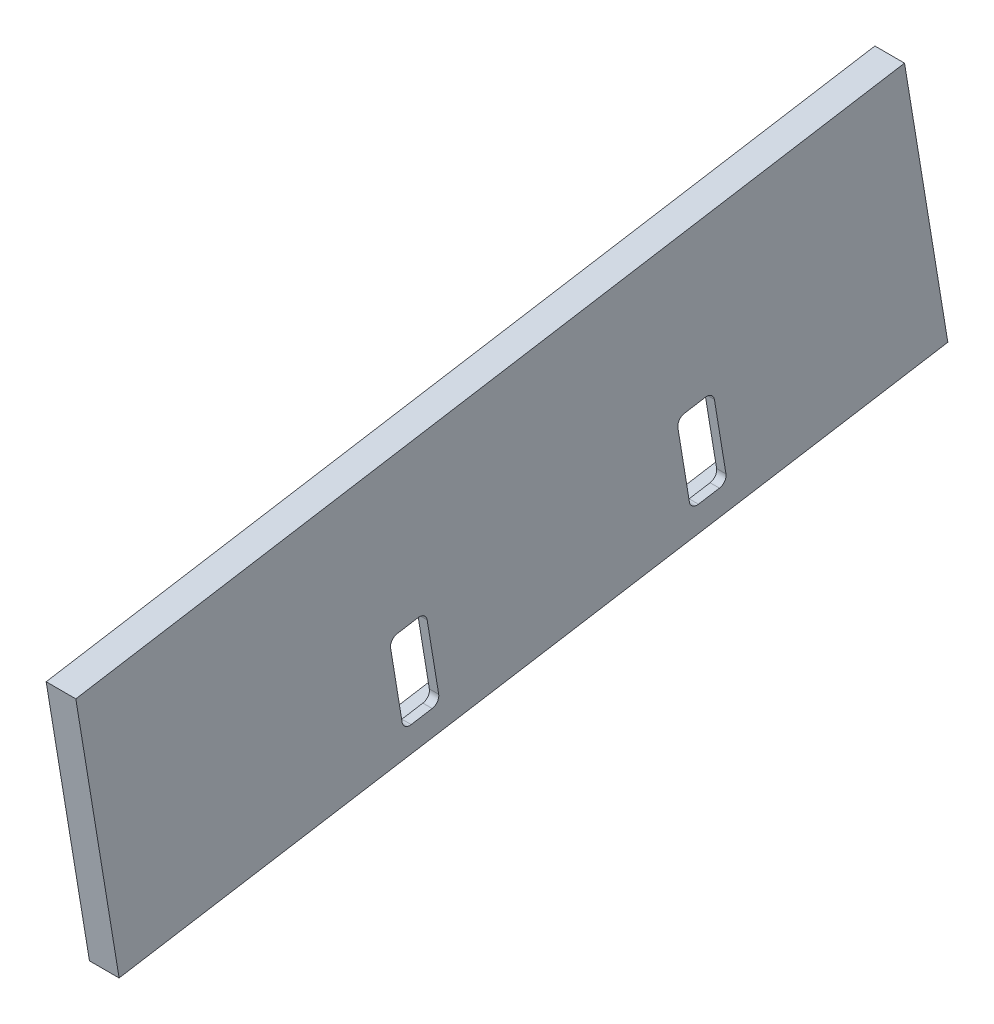
from build123d import *

# Parameters (mm, degrees)
BOSS_EXTRUDE1_START     = -109.652
BOSS_EXTRUDE1_DEPTH     = 9.525
CUT_EXTRUDE1_DEPTH      = 1399.485644649
CUT_EXTRUDE1_DEPTH_BACK = 1399.485644649
CUT_EXTRUDE2_START      = -103.127
CUT_EXTRUDE2_DEPTH      = 1296.358644649


with BuildPart() as part:
    # Sketch1 → Boss-Extrude1 (new body)
    with BuildSketch(Plane(origin=(0, 0, 0), x_dir=(0, 0, -1), z_dir=(1, 0, 0)).offset(BOSS_EXTRUDE1_START)):
        Polygon((-1044.923144897, 473.87249639), (-1311.176339914, 430.114447736), (-1297.268878193, 345.492161514), (-1031.015683176, 389.250210169), align=None)
    extrude(amount=BOSS_EXTRUDE1_DEPTH)

    # Sketch2 → Cut-Extrude1 (cut, two sides: drawn at the far end of the back side and taken through both)
    with BuildSketch(Plane(origin=(0, 0, 0), x_dir=(0, 0, -1), z_dir=(1, 0, 0)).offset(-CUT_EXTRUDE1_DEPTH_BACK)):
        with BuildLine():
            Line((-1108.923879409, 412.894172152), (-1115.653599818, 411.788159384))
            ThreePointArc((-1115.653599818, 411.788159384), (-1117.305228207, 410.762789477), (-1117.748059826, 408.869865828))
            Line((-1117.748059826, 408.869865828), (-1114.045674009, 386.34207761))
            ThreePointArc((-1114.045674009, 386.34207761), (-1113.020304102, 384.690449222), (-1111.127380454, 384.247617603))
            Line((-1111.127380454, 384.247617603), (-1104.397660044, 385.35363037))
            ThreePointArc((-1104.397660044, 385.35363037), (-1102.746031655, 386.379000278), (-1102.303200036, 388.271923926))
            Line((-1102.303200036, 388.271923926), (-1106.005585853, 410.799712144))
            ThreePointArc((-1106.005585853, 410.799712144), (-1107.03095576, 412.451340533), (-1108.923879409, 412.894172152))
        make_face()
        with BuildLine():
            Line((-1206.337571934, 371.174134332), (-1210.039957751, 393.70192255))
            ThreePointArc((-1210.039957751, 393.70192255), (-1209.597126132, 395.594846198), (-1207.945497743, 396.620216105))
            Line((-1207.945497743, 396.620216105), (-1201.215777333, 397.726228873))
            ThreePointArc((-1201.215777333, 397.726228873), (-1199.322853685, 397.283397254), (-1198.297483778, 395.631768865))
            Line((-1198.297483778, 395.631768865), (-1194.595097961, 373.103980647))
            ThreePointArc((-1194.595097961, 373.103980647), (-1195.03792958, 371.211056999), (-1196.689557968, 370.185687092))
            Line((-1196.689557968, 370.185687092), (-1203.419278378, 369.079674324))
            ThreePointArc((-1203.419278378, 369.079674324), (-1205.312202026, 369.522505943), (-1206.337571934, 371.174134332))
        make_face()
    extrude(amount=CUT_EXTRUDE1_DEPTH + CUT_EXTRUDE1_DEPTH_BACK, mode=Mode.SUBTRACT)

    # Sketch3 → Cut-Extrude2 (cut, through all)
    with BuildSketch(Plane(origin=(0, 0, 0), x_dir=(0, 0, -1), z_dir=(1, 0, 0)).offset(CUT_EXTRUDE2_START)):
        with BuildLine():
            Line((-1095.503116711, 383.770114016), (-1114.13319278, 380.708307472))
            ThreePointArc((-1114.13319278, 380.708307472), (-1115.623683889, 381.056993797), (-1116.431061795, 382.357488633))
            Line((-1116.431061795, 382.357488633), (-1122.416828748, 418.778892809))
            ThreePointArc((-1122.416828748, 418.778892809), (-1122.068142423, 420.269383918), (-1120.767647587, 421.076761824))
            Line((-1120.767647587, 421.076761824), (-1102.137571518, 424.138568369))
            ThreePointArc((-1102.137571518, 424.138568369), (-1100.647080409, 423.789882043), (-1099.839702503, 422.489387207))
            Line((-1099.839702503, 422.489387207), (-1093.85393555, 386.067983031))
            ThreePointArc((-1093.85393555, 386.067983031), (-1094.202621875, 384.577491922), (-1095.503116711, 383.770114016))
        make_face()
        with BuildLine():
            Line((-1194.429469443, 408.97062509), (-1213.059545512, 405.908818545))
            ThreePointArc((-1213.059545512, 405.908818545), (-1214.360040348, 405.10144064), (-1214.708726673, 403.61094953))
            Line((-1214.708726673, 403.61094953), (-1208.722959719, 367.189545354))
            ThreePointArc((-1208.722959719, 367.189545354), (-1207.915581814, 365.889050518), (-1206.425090705, 365.540364193))
            Line((-1206.425090705, 365.540364193), (-1187.795014635, 368.602170738))
            ThreePointArc((-1187.795014635, 368.602170738), (-1186.4945198, 369.409548643), (-1186.145833474, 370.900039753))
            Line((-1186.145833474, 370.900039753), (-1192.131600428, 407.321443929))
            ThreePointArc((-1192.131600428, 407.321443929), (-1192.938978333, 408.621938765), (-1194.429469443, 408.97062509))
        make_face()
    extrude(amount=-CUT_EXTRUDE2_DEPTH, mode=Mode.SUBTRACT)


solid = part.part
